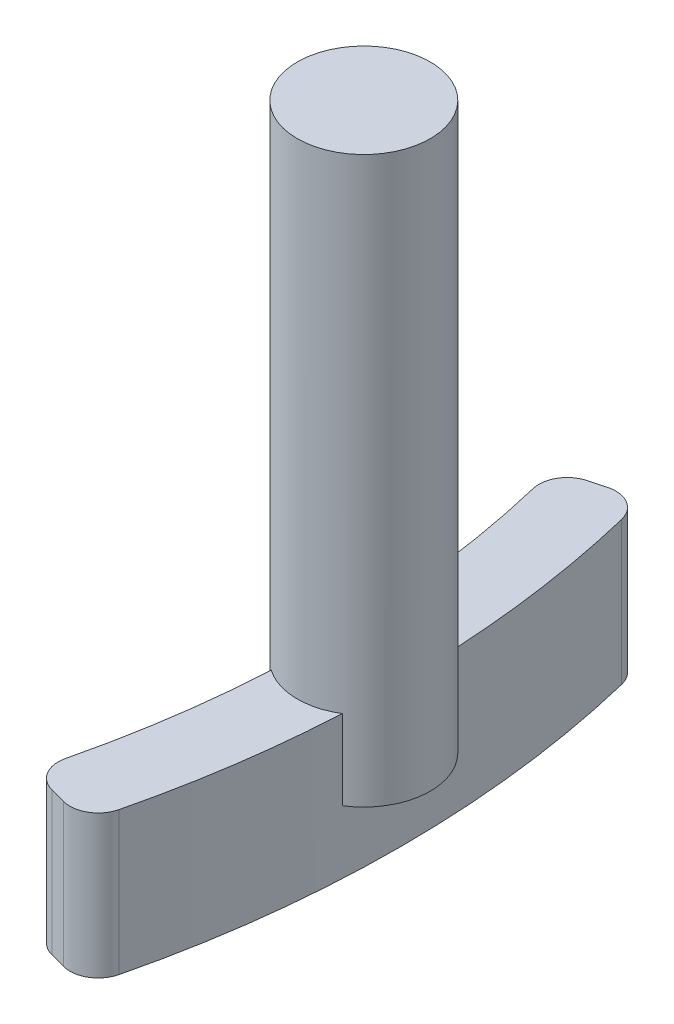
from build123d import *

# Parameters (mm, degrees)
EXTRUDE_1_DEPTH = 4.3
SKETCH_2_R      = 2
EXTRUDE_2_DEPTH = 17


with BuildPart() as part:
    # Эскиз1 → Бобышка-Вытянуть1 (new body)
    with BuildSketch(Plane(origin=(0, 0, 0), x_dir=(1, 0, 0), z_dir=(0, 1, 0))):
        with BuildLine():
            Line((-0.901247468, -8.05291062), (-0.418143138, -8.182358035))
            ThreePointArc((-0.418143138, -8.182358035), (0.23565654, -8.092289298), (0.627933419, -7.561549016))
            ThreePointArc((0.627933419, -7.561549016), (1.53125128, 0), (0.627933419, 7.561549016))
            ThreePointArc((0.627933419, 7.561549016), (0.23565654, 8.092289298), (-0.418143138, 8.182358035))
            Line((-0.418143138, 8.182358035), (-0.901247468, 8.05291062))
            ThreePointArc((-0.901247468, 8.05291062), (-1.412134812, 7.665819819), (-1.507409746, 7.031968217))
            ThreePointArc((-1.507409746, 7.031968217), (-0.66874872, 0), (-1.507409746, -7.031968217))
            ThreePointArc((-1.507409746, -7.031968217), (-1.412134812, -7.665819819), (-0.901247468, -8.05291062))
        make_face()
    extrude(amount=EXTRUDE_1_DEPTH)

    # Эскиз2 → Бобышка-Вытянуть2 (add)
    with BuildSketch(Plane(origin=(0, 1.9, 0), x_dir=(1, 0, 0), z_dir=(0, 1, 0))):
        with Locations(Location((0.43125128, 0, 0), (0, 0, 58.163304996))):
            Circle(SKETCH_2_R)
    extrude(amount=EXTRUDE_2_DEPTH)


solid = part.part
